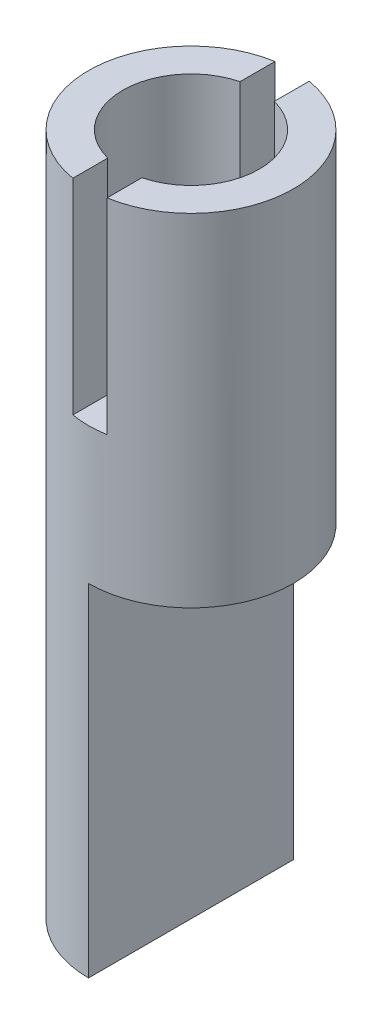
from build123d import *

# Parameters (mm, degrees)
SKETCH1_R           = 3
BOSS_EXTRUDE1_DEPTH = 20
CUT_EXTRUDE1_DEPTH  = 10
CUT_EXTRUDE2_DEPTH  = 6


with BuildPart() as part:
    # Sketch1 → Boss-Extrude1 (new body)
    with BuildSketch(Plane(origin=(0, 0, 0), x_dir=(1, 0, 0), z_dir=(0, 1, 0))):
        with Locations(Location((0, 0, 0), (0, 0, 270))):
            Circle(SKETCH1_R)
    extrude(amount=BOSS_EXTRUDE1_DEPTH)

    # Sketch2 → Cut-Extrude1 (cut)
    with BuildSketch(Plane.XZ):
        with BuildLine():
            Line((0, 3), (0, -3))
            ThreePointArc((0, -3), (3, 0), (0, 3))
        make_face()
    extrude(amount=-CUT_EXTRUDE1_DEPTH, mode=Mode.SUBTRACT)

    # Sketch3 → Cut-Extrude2 (cut)
    with BuildSketch(Plane(origin=(0, 20, 0), x_dir=(1, 0, 0), z_dir=(0, 1, 0))):
        with BuildLine():
            Line((-0.5, -1.936491673), (-0.5, -3.922731478))
            Line((-0.5, -3.922731478), (0.5, -3.922731478))
            Line((0.5, -3.922731478), (0.5, -1.936491673))
            ThreePointArc((0.5, -1.936491673), (2, 0), (0.5, 1.936491673))
            Line((0.5, 1.936491673), (0.5, 3.922731478))
            Line((0.5, 3.922731478), (-0.5, 3.922731478))
            Line((-0.5, 3.922731478), (-0.5, 1.936491673))
            ThreePointArc((-0.5, 1.936491673), (-2, 0), (-0.5, -1.936491673))
        make_face()
    extrude(amount=-CUT_EXTRUDE2_DEPTH, mode=Mode.SUBTRACT)


solid = part.part
